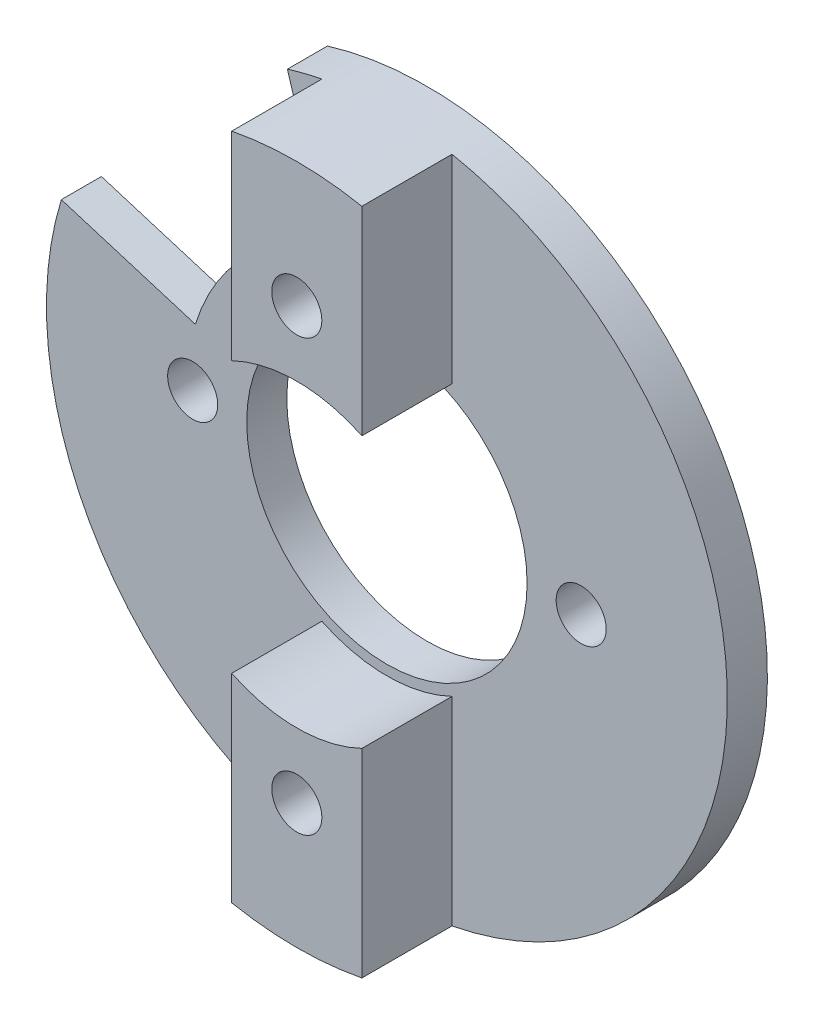
from build123d import *

# Parameters (mm, degrees)
SKETCH_1_R          = 17
EXTRUDE_1_DEPTH     = 2
SKETCH_2_R          = 7
CUT_EXTRUDE_1_DEPTH = 2
CUT_EXTRUDE_3_DEPTH = 2.5
EXTRUDE_6_DEPTH     = 4.5
SKETCH_25_R         = 1.25
CUT_EXTRUDE_4_DEPTH = 4
SKETCH_27_R         = 1.25
CUT_EXTRUDE_5_DEPTH = 2


with BuildPart() as part:
    # 草图1 → 凸台-拉伸1 (new body)
    with BuildSketch(Plane.XY):
        Circle(SKETCH_1_R)
    extrude(amount=EXTRUDE_1_DEPTH)

    # 草图2 → 切除-拉伸1 (cut)
    with BuildSketch(Plane(origin=(0, 0, 0), x_dir=(-1, 0, 0), z_dir=(0, 0, -1))):
        Circle(SKETCH_2_R)
    extrude(amount=-CUT_EXTRUDE_1_DEPTH, mode=Mode.SUBTRACT)

    # 草图11 → 切除-拉伸3 (cut)
    with BuildSketch(Plane(origin=(0, 0, 0), x_dir=(-1, 0, 0), z_dir=(0, 0, -1))):
        with BuildLine():
            Line((4.97031898, 16.257180851), (2.923717047, 9.56304756))
            ThreePointArc((2.923717047, 9.56304756), (7.071067812, 7.071067812), (9.56304756, 2.923717047))
            Line((9.56304756, 2.923717047), (16.257180851, 4.97031898))
            ThreePointArc((16.257180851, 4.97031898), (12.02081528, 12.02081528), (4.97031898, 16.257180851))
        make_face()
    extrude(amount=-CUT_EXTRUDE_3_DEPTH, mode=Mode.SUBTRACT)

    # 草图24 → 凸台-拉伸6 (add)
    with BuildSketch(Plane.XY.offset(2)):
        with BuildLine():
            Line((3.25, 16.686446596), (3.25, 6.759252917))
            ThreePointArc((3.25, 6.759252917), (0, 7.5), (-3.25, 6.759252917))
            Line((-3.25, 6.759252917), (-3.25, 16.686446596))
            ThreePointArc((-3.25, 16.686446596), (0, 17), (3.25, 16.686446596))
        make_face()
        with BuildLine():
            Line((3.25, -16.686446596), (3.25, -6.759252917))
            ThreePointArc((3.25, -6.759252917), (0, -7.5), (-3.25, -6.759252917))
            Line((-3.25, -6.759252917), (-3.25, -16.686446596))
            ThreePointArc((-3.25, -16.686446596), (0, -17), (3.25, -16.686446596))
        make_face()
    extrude(amount=EXTRUDE_6_DEPTH)

    # 草图25 → 切除-拉伸4 (cut)
    with BuildSketch(Plane.XY.offset(6.5)):
        with Locations((0, 10.75)):
            Circle(SKETCH_25_R)
        with Locations(Location((0, -10.75, 0), (0, 0, 180))):
            Circle(SKETCH_25_R)
    extrude(amount=-CUT_EXTRUDE_4_DEPTH, mode=Mode.SUBTRACT)

    # 草图27 → 切除-拉伸5 (cut)
    with BuildSketch(Plane(origin=(0, 0, 0), x_dir=(-1, 0, 0), z_dir=(0, 0, -1))):
        with Locations((-9.7, 0)):
            Circle(SKETCH_27_R)
        with Locations((9.7, 0)):
            Circle(SKETCH_27_R)
    extrude(amount=-CUT_EXTRUDE_5_DEPTH, mode=Mode.SUBTRACT)


solid = part.part
